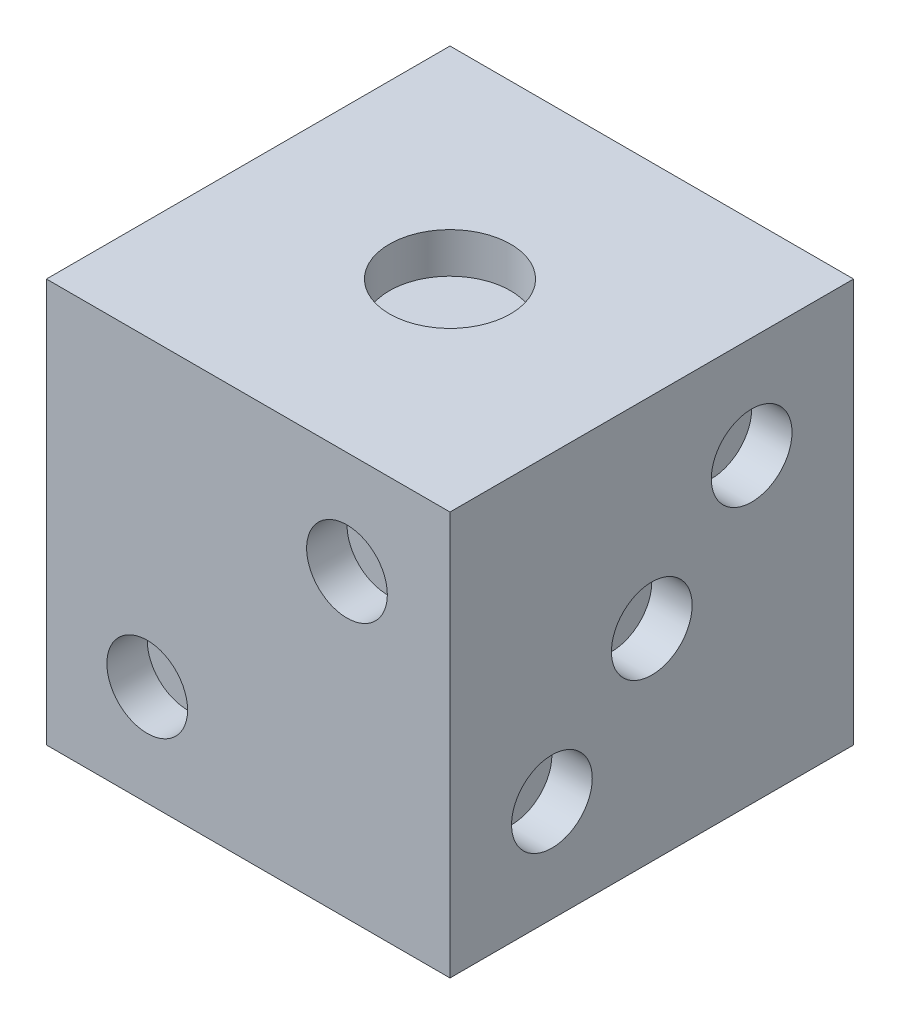
from build123d import *

# Parameters (mm, degrees)
SKETCH7_W           = 100
SKETCH7_H           = 100
BOSS_EXTRUDE1_DEPTH = 100
SKETCH8_R           = 15
CUT_EXTRUDE1_DEPTH  = 10
SKETCH9_R           = 10
CUT_EXTRUDE2_DEPTH  = 10
SKETCH10_R          = 10
CUT_EXTRUDE3_DEPTH  = 10
SKETCH13_R          = 12.5
CUT_EXTRUDE4_DEPTH  = 10
SKETCH14_R          = 12.5
CUT_EXTRUDE5_DEPTH  = 10
SKETCH16_R          = 12.5
CUT_EXTRUDE11_DEPTH = 10


with BuildPart() as part:
    # Sketch7 → Boss-Extrude1 (new body)
    with BuildSketch(Plane(origin=(0, 0, 0), x_dir=(1, 0, 0), z_dir=(0, 1, 0))):
        Rectangle(SKETCH7_W, SKETCH7_H)
    extrude(amount=BOSS_EXTRUDE1_DEPTH)

    # Sketch8 → Cut-Extrude1 (cut)
    with BuildSketch(Plane(origin=(0, 100, 0), x_dir=(1, 0, 0), z_dir=(0, 1, 0))):
        with Locations(Location((0, 0, 0), (0, 0, 270))):
            Circle(SKETCH8_R)
    extrude(amount=-CUT_EXTRUDE1_DEPTH, mode=Mode.SUBTRACT)

    # Sketch9 → Cut-Extrude2 (cut)
    with BuildSketch(Plane(origin=(50, 0, 0), x_dir=(0, 0, -1), z_dir=(1, 0, 0))):
        with Locations((0, 50)):
            Circle(SKETCH9_R)
        with Locations((24.748737342, 74.748737342)):
            Circle(SKETCH9_R)
        with Locations((-24.748737342, 25.251262658)):
            Circle(SKETCH9_R)
    extrude(amount=-CUT_EXTRUDE2_DEPTH, mode=Mode.SUBTRACT)

    # Sketch10 → Cut-Extrude3 (cut)
    with BuildSketch(Plane.XY.offset(50)):
        with Locations((-25.023456699, 24.976543301)):
            Circle(SKETCH10_R)
        with Locations((24.474017984, 74.474017984)):
            Circle(SKETCH10_R)
    extrude(amount=-CUT_EXTRUDE3_DEPTH, mode=Mode.SUBTRACT)

    # Sketch13 → Cut-Extrude4 (cut)
    with BuildSketch(Plane(origin=(0, 0, 0), x_dir=(-1, 0, 0), z_dir=(0, -1, 0))):
        with Locations(Location((25, -25, 0), (0, 0, 90))):
            Circle(SKETCH13_R)
        with Locations(Location((-25, -25, 0), (0, 0, 90))):
            Circle(SKETCH13_R)
        with Locations(Location((25, 25, 0), (0, 0, 90))):
            Circle(SKETCH13_R)
        with Locations(Location((-25, 25, 0), (0, 0, 90))):
            Circle(SKETCH13_R)
    extrude(amount=-CUT_EXTRUDE4_DEPTH, mode=Mode.SUBTRACT)

    # Sketch14 → Cut-Extrude5 (cut)
    with BuildSketch(Plane(origin=(0, 0, -50), x_dir=(-1, 0, 0), z_dir=(0, 0, -1))):
        with Locations((25, 25)):
            Circle(SKETCH14_R)
        with Locations((-25, 25)):
            Circle(SKETCH14_R)
        with Locations((25, 75)):
            Circle(SKETCH14_R)
        with Locations((-25, 75)):
            Circle(SKETCH14_R)
        with Locations((0, 50)):
            Circle(SKETCH14_R)
    extrude(amount=-CUT_EXTRUDE5_DEPTH, mode=Mode.SUBTRACT)

    # Sketch16 → Cut-Extrude11 (cut)
    with BuildSketch(Plane.ZY.offset(50)):
        with Locations((-35, 75)):
            Circle(SKETCH16_R)
        with Locations((0, 75)):
            Circle(SKETCH16_R)
        with Locations((35, 75)):
            Circle(SKETCH16_R)
        with Locations((-35, 25)):
            Circle(SKETCH16_R)
        with Locations((0, 25)):
            Circle(SKETCH16_R)
        with Locations((35, 25)):
            Circle(SKETCH16_R)
    extrude(amount=-CUT_EXTRUDE11_DEPTH, mode=Mode.SUBTRACT)


solid = part.part
